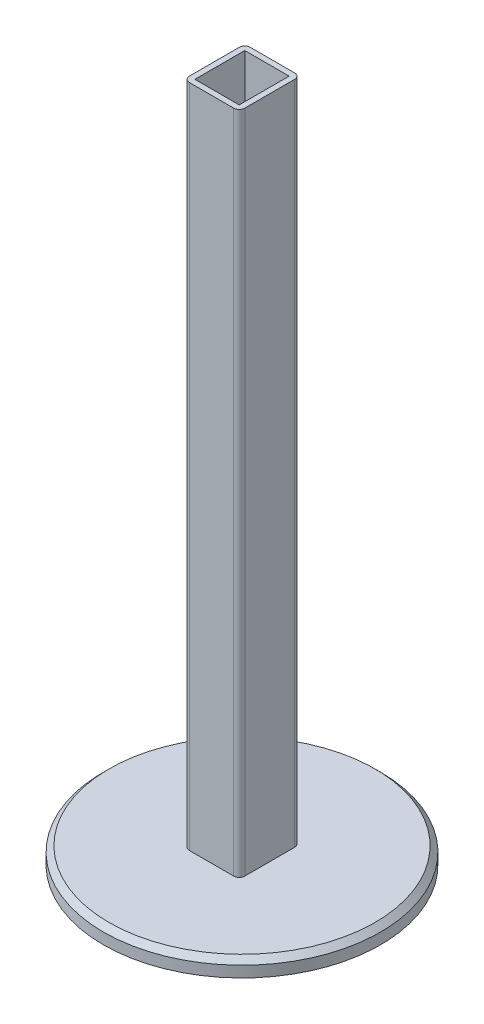
from build123d import *

# Parameters (mm, degrees)
SKETCH1_R           = 250
BOSS_EXTRUDE1_DEPTH = 30
SKETCH2_W           = 100
SKETCH2_H           = 110
BOSS_EXTRUDE2_DEPTH = 1200
CHAMFER1_SIZE       = 10
FILLET1_R           = 10
SKETCH3_W           = 80
SKETCH3_H           = 90
CUT_EXTRUDE1_DEPTH  = 1170


with BuildPart() as part:
    # Sketch1 → Boss-Extrude1 (new body)
    with BuildSketch(Plane(origin=(0, 0, 0), x_dir=(1, 0, 0), z_dir=(0, 1, 0))):
        with Locations(Location((0, 0, 0), (0, 0, 270))):
            Circle(SKETCH1_R)
    extrude(amount=BOSS_EXTRUDE1_DEPTH)

    # Sketch2 → Boss-Extrude2 (add)
    with BuildSketch(Plane(origin=(0, 30, 0), x_dir=(1, 0, 0), z_dir=(0, 1, 0))):
        Rectangle(SKETCH2_W, SKETCH2_H)
    extrude(amount=BOSS_EXTRUDE2_DEPTH)

    # Chamfer1
    chamfer1_edges = [part.edges().sort_by_distance(p)[0] for p in [
        (0, 30, -250),
    ]]
    chamfer(chamfer1_edges, length=CHAMFER1_SIZE)

    # Fillet1
    fillet1_edges = [part.edges().sort_by_distance(p)[0] for p in [
        (-50, 630, -55),
        (-50, 630, 55),
        (50, 630, 55),
        (50, 630, -55),
    ]]
    fillet(fillet1_edges, radius=FILLET1_R)

    # Sketch3 → Cut-Extrude1 (cut)
    with BuildSketch(Plane(origin=(0, 1230, 0), x_dir=(1, 0, 0), z_dir=(0, 1, 0))):
        Rectangle(SKETCH3_W, SKETCH3_H)
    extrude(amount=-CUT_EXTRUDE1_DEPTH, mode=Mode.SUBTRACT)


solid = part.part
